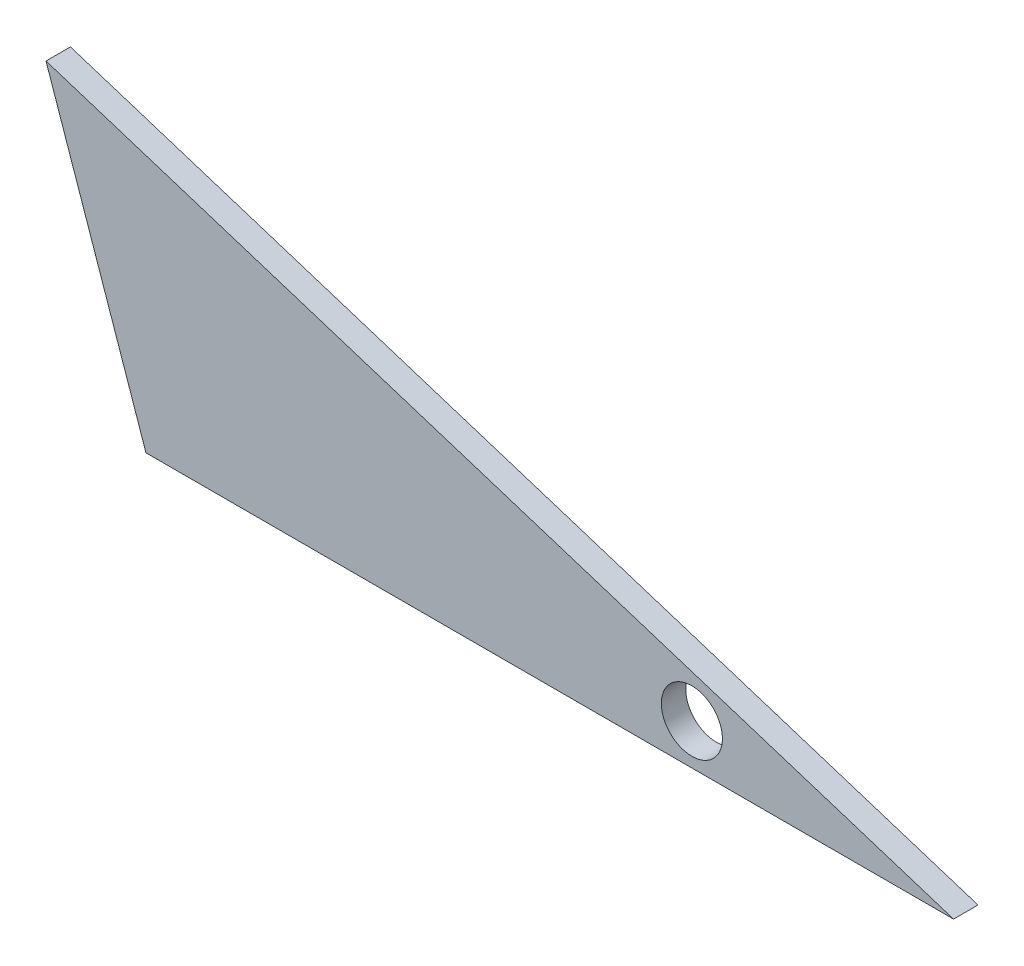
from build123d import *

# Parameters (mm, degrees)
SKETCH1_R           = 4.7625
BOSS_EXTRUDE1_DEPTH = 3.81


with BuildPart() as part:
    # Sketch1 → Boss-Extrude1 (new body)
    with BuildSketch(Plane.XY):
        Polygon((0, 0), (-15.59380337, 45.13409798), (125.964112688, 0), align=None)
        with Locations(Location((85.144206279, 6.35, 0), (0, 0, 180))):
            Circle(SKETCH1_R, mode=Mode.SUBTRACT)
    extrude(amount=BOSS_EXTRUDE1_DEPTH)


solid = part.part
